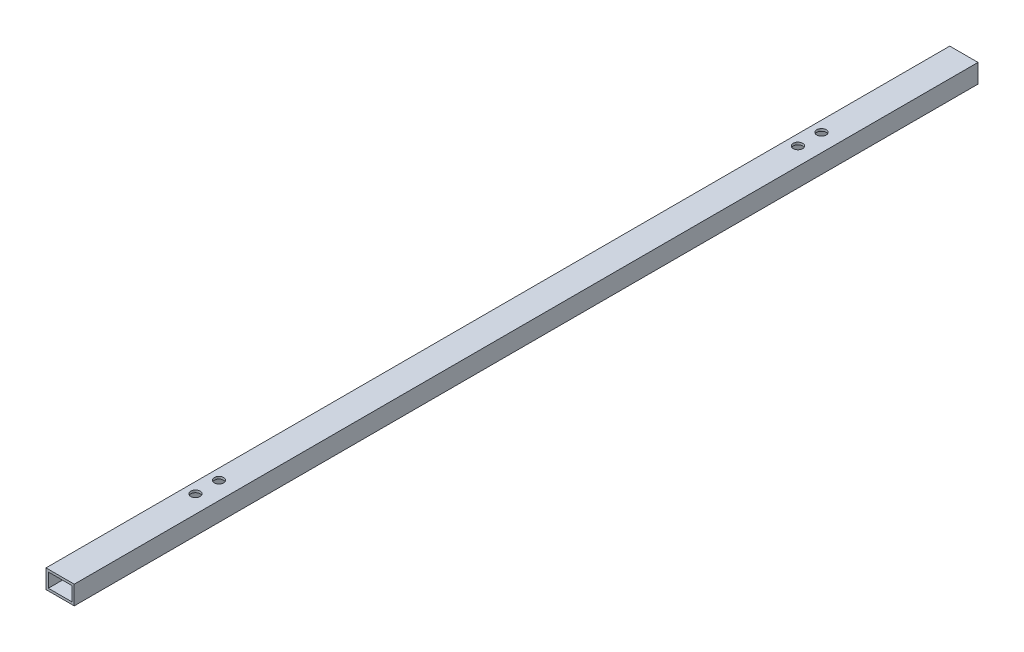
from build123d import *

# Parameters (mm, degrees)
BOSS_EXTRUDE1_DEPTH      = 609.6
BOSS_EXTRUDE1_DEPTH_BACK = 609.6
SKETCH3_W                = 38.1
SKETCH3_H                = 25.4
SKETCH3_W_2              = 31.75
SKETCH3_H_2              = 19.05
SKETCH6_R                = 6.35
CUT_EXTRUDE1_DEPTH       = 611.426262951


with BuildPart() as part:
    # Sketch3 → Boss-Extrude1 (new, two sides: drawn at the far end of the back side and taken through both)
    with BuildSketch(Plane.XY.offset(-BOSS_EXTRUDE1_DEPTH_BACK)):
        Rectangle(SKETCH3_W, SKETCH3_H)
        Rectangle(SKETCH3_W_2, SKETCH3_H_2, mode=Mode.SUBTRACT)
    extrude(amount=BOSS_EXTRUDE1_DEPTH + BOSS_EXTRUDE1_DEPTH_BACK)

    # Sketch6 → Cut-Extrude1 (cut, through all)
    with BuildSketch(Plane(origin=(0, 12.7, 0), x_dir=(1, 0, 0), z_dir=(0, 1, 0))):
        with Locations(Location((-4.7625, -390.525, 0), (0, 0, 270))):
            Circle(SKETCH6_R)
        with Locations(Location((-4.7625, -422.275, 0), (0, 0, 270))):
            Circle(SKETCH6_R)
        with Locations(Location((-4.7625, 422.275, 0), (0, 0, 270))):
            Circle(SKETCH6_R)
        with Locations(Location((-4.7625, 390.525, 0), (0, 0, 270))):
            Circle(SKETCH6_R)
    extrude(amount=-CUT_EXTRUDE1_DEPTH, mode=Mode.SUBTRACT)


solid = part.part
